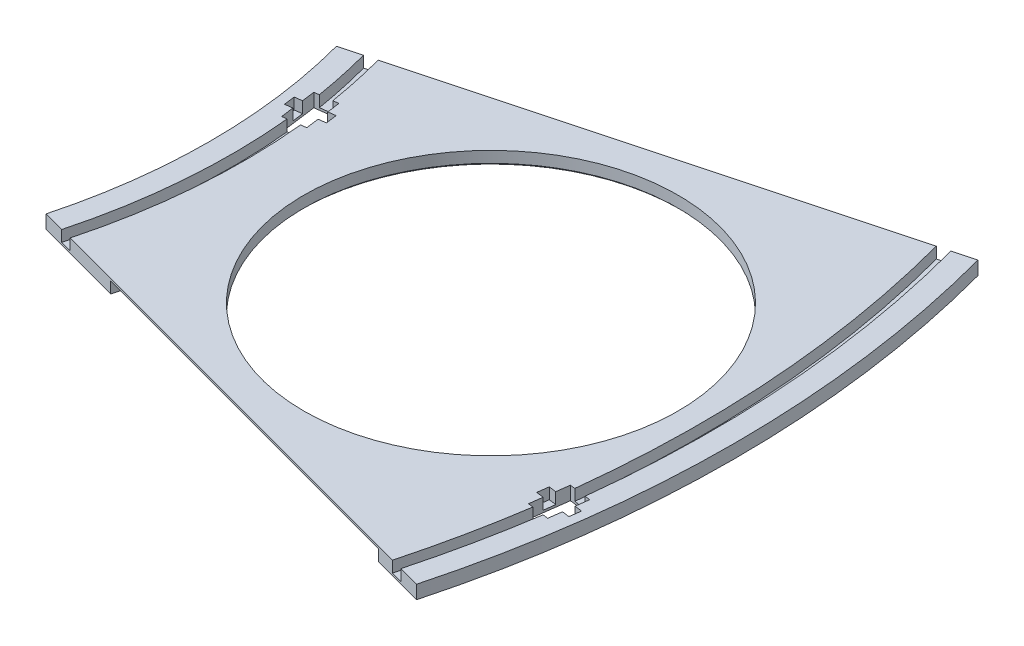
from build123d import *

# Parameters (mm, degrees)
SKIZZE1_R                       = 50
AUFSATZ_LINEAR_AUSTRAGEN1_DEPTH = 3.6
SCHNITT_LINEAR_AUSTRAGEN1_DEPTH = 3
SCHNITT_LINEAR_AUSTRAGEN2_DEPTH = 300.577355237
SCHNITT_LINEAR_AUSTRAGEN3_DEPTH = 3
FASE1_SIZE                      = 0.6
SCHNITT_LINEAR_AUSTRAGEN4_DEPTH = 300.577355237
AUFSATZ_LINEAR_AUSTRAGEN4_DEPTH = 101.2
AUFSATZ_LINEAR_AUSTRAGEN5_DEPTH = 101.2


with BuildPart() as part:
    # Skizze1 → Aufsatz-Linear austragen1 (new body)
    with BuildSketch(Plane(origin=(0, 0, 0), x_dir=(1, 0, 0), z_dir=(0, 1, 0))):
        with BuildLine():
            Line((280.118489624, 75.05752308), (144.888873943, 38.822856765))
            ThreePointArc((144.888873943, 38.822856765), (150, 0), (144.888873943, -38.822856765))
            Line((144.888873943, -38.822856765), (280.118489624, -75.05752308))
            ThreePointArc((280.118489624, -75.05752308), (290, 0), (280.118489624, 75.05752308))
        make_face()
        with Locations(Location((225, 0, 0), (0, 0, 270))):
            Circle(SKIZZE1_R, mode=Mode.SUBTRACT)
    extrude(amount=AUFSATZ_LINEAR_AUSTRAGEN1_DEPTH)

    # Skizze2 → Schnitt-Linear austragen1 (cut)
    with BuildSketch(Plane(origin=(0, 3.6, 0), x_dir=(1, 0, 0), z_dir=(0, 1, 0))):
        with BuildLine():
            Line((150.587836318, 40.349889131), (153.678798963, 41.178110076))
            ThreePointArc((153.678798963, 41.178110076), (159.1, 0), (153.678798963, -41.178110076))
            Line((153.678798963, -41.178110076), (150.587836318, -40.349889131))
            ThreePointArc((150.587836318, -40.349889131), (155.9, 0), (150.587836318, 40.349889131))
        make_face()
        with BuildLine():
            Line((271.328564605, 72.702269769), (274.419527249, 73.530490714))
            ThreePointArc((274.419527249, 73.530490714), (284.1, 0), (274.419527249, -73.530490714))
            Line((274.419527249, -73.530490714), (271.328564605, -72.702269769))
            ThreePointArc((271.328564605, -72.702269769), (280.9, 0), (271.328564605, 72.702269769))
        make_face()
    extrude(amount=-SCHNITT_LINEAR_AUSTRAGEN1_DEPTH, mode=Mode.SUBTRACT)

    # Skizze3 → Schnitt-Linear austragen2 (cut, through all)
    with BuildSketch(Plane(origin=(0, 3.6, 0), x_dir=(1, 0, 0), z_dir=(0, 1, 0))):
        Polygon((152.525600121, 25.123521005), (158.474269289, 25.906678158), (159.779531212, 15.992229544), (153.830862043, 15.209072391), align=None)
        Polygon((276.456207793, -41.439295032), (282.404876961, -42.222452186), (283.710138883, -32.308003572), (277.761469715, -31.524846419), align=None)
    extrude(amount=-SCHNITT_LINEAR_AUSTRAGEN2_DEPTH, mode=Mode.SUBTRACT)

    # Skizze4 → Schnitt-Linear austragen3 (cut)
    with BuildSketch(Plane(origin=(0, 3.6, 0), x_dir=(1, 0, 0), z_dir=(0, 1, 0))):
        Polygon((150.999552071, 21.392411606), (160.914000685, 22.697673528), (161.305579262, 19.723338944), (151.391130648, 18.418077021), align=None)
        Polygon((275.32173832, -34.733851049), (285.236186933, -36.039112971), (284.844608357, -39.013447555), (274.930159743, -37.708185633), align=None)
    extrude(amount=-SCHNITT_LINEAR_AUSTRAGEN3_DEPTH, mode=Mode.SUBTRACT)

    # Fase1
    fase1_edges = [part.edges().sort_by_distance(p)[0] for p in [
        (225, 0, -50),
    ]]
    chamfer(fase1_edges, length=FASE1_SIZE)

    # Skizze5 → Schnitt-Linear austragen4 (cut, through all)
    with BuildSketch(Plane.XZ):
        Polygon((168.457464105, 45.138041466), (266.209157725, 71.33052883), (268.020891041, 64.569048046), (170.269197421, 38.376560682), align=None)
        Polygon((168.457464105, -45.138041466), (266.209157725, -71.33052883), (268.020891041, -64.569048046), (170.269197421, -38.376560682), align=None)
    extrude(amount=-SCHNITT_LINEAR_AUSTRAGEN4_DEPTH, mode=Mode.SUBTRACT)

    # Skizze6 → Aufsatz-Linear austragen4 (add)
    with BuildSketch(Plane(origin=(168.457464105, 0, 45.138041466), x_dir=(0.25881904510252185, 0, -0.965925826289068), z_dir=(0.9659258262890681, 0, 0.25881904510252185))):
        Polygon((0, 3.6), (7, 3.6), (7, 0), (0, 3), align=None)
    extrude(amount=AUFSATZ_LINEAR_AUSTRAGEN4_DEPTH)

    # Skizze7 → Aufsatz-Linear austragen5 (add)
    with BuildSketch(Plane(origin=(168.457464105, 0, -45.138041466), x_dir=(-0.2588190451025227, 0, -0.9659258262890678), z_dir=(0.9659258262890678, 0, -0.2588190451025227))):
        Polygon((-7, 0), (-7, 3.6), (0, 3.6), (0, 3), align=None)
    extrude(amount=AUFSATZ_LINEAR_AUSTRAGEN5_DEPTH)


solid = part.part
